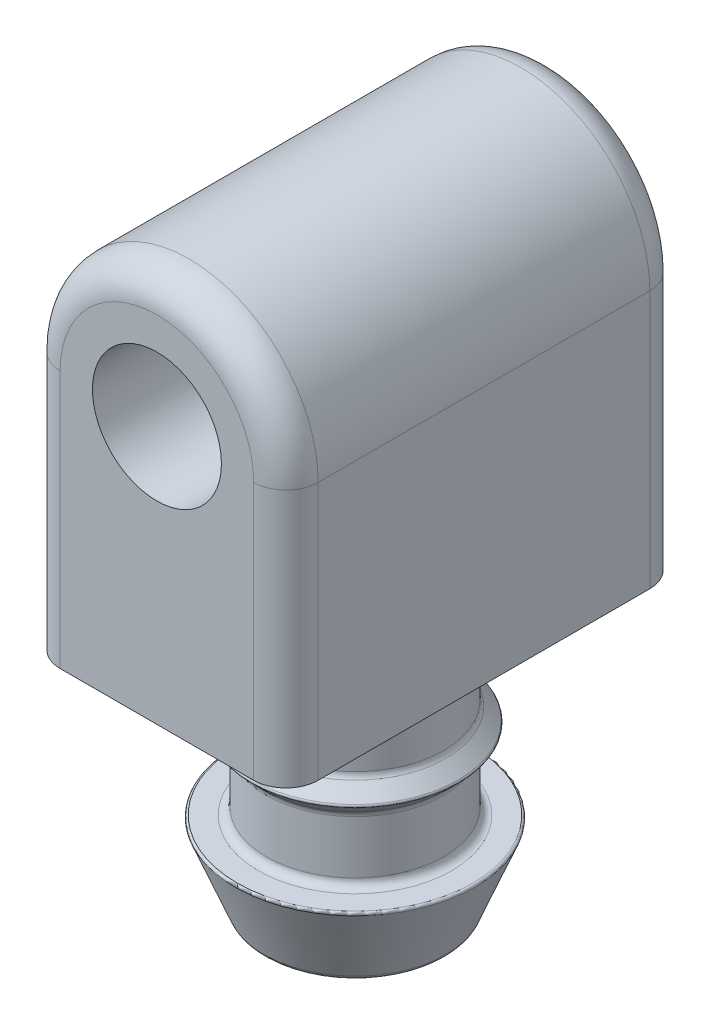
from build123d import *

# Parameters (mm, degrees)
SKETCH1_R           = 3.175
BOSS_EXTRUDE1_DEPTH = 9.75
SKETCH3_R           = 2.38125
CUT_EXTRUDE1_DEPTH  = 20.6375
FILLET1_R           = 1.5875
FILLET2_R           = 0.396875
FILLET3_R           = 0.09921875
CHAMFER2_SIZE       = 0.254


with BuildPart() as part:
    # Sketch1 → Boss-Extrude1 (new, symmetric)
    with BuildSketch(Plane.XY):
        with BuildLine():
            Line((-6.35, 0), (-6.35, -12.7))
            Line((-6.35, -12.7), (6.35, -12.7))
            Line((6.35, -12.7), (6.35, 0))
            ThreePointArc((6.35, 0), (0, 6.35), (-6.35, 0))
        make_face()
        Circle(SKETCH1_R, mode=Mode.SUBTRACT)
    extrude(amount=BOSS_EXTRUDE1_DEPTH, both=True)

    # Sketch2 → Revolve1 (revolve)
    with BuildSketch(Plane.XY, mode=Mode.PRIVATE) as revolve1_sk:
        Polygon((0, -12.7), (4.365625, -12.7), (4.365625, -16.66875), (5.159375, -17.4625), (4.365625, -18.25625), (4.365625, -21.43125), (5.953125, -21.43125), (4.365625, -25.4), (0, -25.4), align=None)
    revolve(revolve1_sk.sketch.rotate(Axis((0, 9.54404991, 0), (0, -1, 0)), 180), axis=Axis((0, 9.54404991, 0), (0, -1, 0)))

    # Sketch3 → Cut-Extrude1 (cut)
    with BuildSketch(Plane.XZ.offset(25.4)):
        Circle(SKETCH3_R)
    extrude(amount=-CUT_EXTRUDE1_DEPTH, mode=Mode.SUBTRACT)

    # Fillet1
    fillet1_edges = [part.edges().sort_by_distance(p)[0] for p in [
        (6.35, -6.35, 9.75),
        (-2.38125, -4.7625, 0),
        (0, 6.35, 9.75),
        (6.35, -6.35, -9.75),
        (-6.35, -6.35, -9.75),
        (0, 6.35, -9.75),
        (-6.35, -6.35, 9.75),
    ]]
    fillet(fillet1_edges, radius=FILLET1_R)

    # Fillet2
    fillet2_edges = [part.edges().sort_by_distance(p)[0] for p in [
        (4.365625, -12.7, 0),
        (4.365625, -16.66875, 0),
        (4.365625, -18.25625, 0),
        (4.365625, -21.43125, 0),
        (4.365625, -25.4, 0),
    ]]
    fillet(fillet2_edges, radius=FILLET2_R)

    # Fillet3
    fillet3_edges = [part.edges().sort_by_distance(p)[0] for p in [
        (5.159375, -17.4625, 0),
        (5.953125, -21.43125, 0),
    ]]
    fillet(fillet3_edges, radius=FILLET3_R)

    # Chamfer2
    chamfer2_edges = [part.edges().sort_by_distance(p)[0] for p in [
        (-2.38125, -25.4, 0),
    ]]
    chamfer(chamfer2_edges, length=CHAMFER2_SIZE)


solid = part.part
